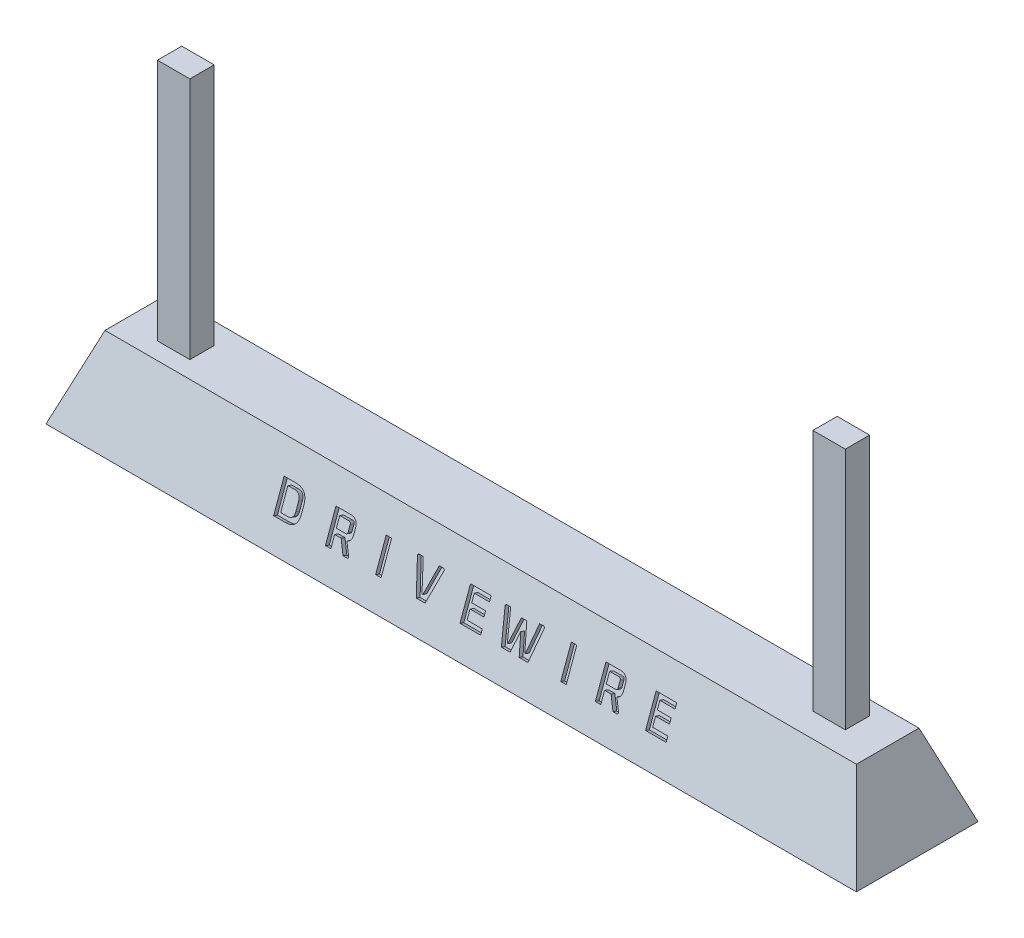
from build123d import *

# Parameters (mm, degrees)
SKETCH1_W           = 200
SKETCH1_H           = 30
BOSS_EXTRUDE1_DEPTH = 20
BOSS_EXTRUDE1_TAPER = 20
SKETCH3_W           = 8
SKETCH3_H           = 6
BOSS_EXTRUDE3_DEPTH = 60
SKETCH4_W           = 1.337512244
SKETCH4_H           = 7.615728082
SKETCH4_W_2         = 1.337512245
CUT_EXTRUDE2_DEPTH  = 1


with BuildPart() as part:
    # Sketch1 → Boss-Extrude1 (new body)
    with BuildSketch(Plane(origin=(0, 0, 0), x_dir=(1, 0, 0), z_dir=(0, 1, 0))):
        Rectangle(SKETCH1_W, SKETCH1_H)
    extrude(amount=BOSS_EXTRUDE1_DEPTH, taper=BOSS_EXTRUDE1_TAPER)

    # Sketch3 → Boss-Extrude3 (add)
    with BuildSketch(Plane(origin=(0, 20, 0), x_dir=(1, 0, 0), z_dir=(0, 1, 0))):
        with Locations((-80, -0.494868003)):
            Rectangle(SKETCH3_W, SKETCH3_H)
        with Locations((80, 1.255131997)):
            Rectangle(SKETCH3_W, SKETCH3_H)
    extrude(amount=BOSS_EXTRUDE3_DEPTH)

    # Sketch4 → Cut-Extrude2 (cut)
    # profile 1 of 9: a face of its own
    with BuildSketch(Plane(origin=(0, 4.820907073, 13.245333323), x_dir=(1, 0, 0), z_dir=(0, 0.34202014332566905, 0.9396926207859083))):
        with BuildLine():
            Line((-46.095717469, 1.487191126), (-46.095717469, 9.102919208))
            Line((-46.095717469, 9.102919208), (-43.190634528, 9.102919208))
            add(Edge.make_bspline(
                [(-43.190634528, 9.102919208), (-43.071016195, 9.101063594), (-42.839167214, 9.097466971), (-42.502816107, 9.061896878), (-42.189339489, 9.004442857), (-41.898969141, 8.921388731), (-41.630719016, 8.817603166), (-41.385787117, 8.688163869), (-41.164198119, 8.535376879), (-40.965184893, 8.359709943), (-40.791209599, 8.159075208), (-40.639480395, 7.935645525), (-40.512641735, 7.68810333), (-40.409506924, 7.417614154), (-40.329013102, 7.124237478), (-40.27076589, 6.807419281), (-40.235600513, 6.4672997), (-40.231916291, 6.23282818), (-40.230020236, 6.112159325)],
                knots=[0, 0, 0, 0, 1.188713315, 2.304011127, 3.357802465, 4.352913975, 5.301847974, 6.21197883, 7.100084463, 7.971523922, 8.843438996, 9.732912908, 10.649926474, 11.601855752, 12.605664396, 13.669791362, 14.800777136, 16, 16, 16, 16], degree=3))
            Line((-40.230020236, 6.112159325), (-40.230020236, 4.477951008))
            add(Edge.make_bspline(
                [(-40.230020236, 4.477951008), (-40.231916291, 4.357282153), (-40.235600513, 4.122810633), (-40.27076589, 3.782691052), (-40.329013102, 3.465872856), (-40.409506924, 3.17249618), (-40.512641735, 2.902007004), (-40.639480395, 2.654464808), (-40.791209599, 2.431035125), (-40.965184893, 2.23040039), (-41.164198119, 2.054733454), (-41.385787117, 1.901946465), (-41.630719016, 1.772507167), (-41.898969141, 1.668721603), (-42.189339489, 1.585667477), (-42.502816107, 1.528213456), (-42.839167214, 1.492643362), (-43.071016195, 1.489046739), (-43.190634528, 1.487191126)],
                knots=[0, 0, 0, 0, 1.199222864, 2.330208638, 3.394335604, 4.398144248, 5.350073526, 6.267087092, 7.156561004, 8.028476078, 8.899915537, 9.78802117, 10.698152026, 11.647086025, 12.642197535, 13.695988873, 14.811286685, 16, 16, 16, 16], degree=3))
            Line((-43.190634528, 1.487191126), (-46.095717469, 1.487191126))
        make_face()
        with BuildLine():
            Line((-44.758205225, 2.704121009), (-43.112890637, 2.704121009))
            add(Edge.make_bspline(
                [(-43.112890637, 2.704121009), (-43.050452885, 2.705450542), (-42.929553728, 2.708024936), (-42.753677974, 2.724678408), (-42.590372998, 2.756772498), (-42.43853406, 2.799620774), (-42.298123955, 2.852912071), (-42.1701269, 2.919795972), (-42.054686071, 3.000023191), (-41.951395571, 3.092236215), (-41.859634223, 3.196245295), (-41.781870799, 3.313641342), (-41.714595908, 3.442605433), (-41.661589422, 3.584708947), (-41.618330602, 3.737401123), (-41.588372135, 3.902605016), (-41.571389778, 4.079880115), (-41.568842183, 4.202372642), (-41.567532481, 4.265345266)],
                knots=[0, 0, 0, 0, 1.189055845, 2.302386679, 3.359069874, 4.353701447, 5.3037939, 6.213754028, 7.096558538, 7.973888864, 8.844546497, 9.729989503, 10.648878363, 11.608371854, 12.612694507, 13.667504363, 14.800878928, 16, 16, 16, 16], degree=3))
            Line((-41.567532481, 4.265345266), (-41.567532481, 6.324765068))
            add(Edge.make_bspline(
                [(-41.567532481, 6.324765068), (-41.568848685, 6.387735705), (-41.571408927, 6.510224369), (-41.588302473, 6.687526597), (-41.618659227, 6.853138496), (-41.66092653, 7.006154839), (-41.715025976, 7.1478701), (-41.781819482, 7.27648839), (-41.859648506, 7.393857292), (-41.951388044, 7.497886227), (-42.054702084, 7.590045938), (-42.170069329, 7.670469959), (-42.298521234, 7.736675512), (-42.437865912, 7.793011539), (-42.590732691, 7.832638647), (-42.75361426, 7.865642307), (-42.929571297, 7.882027387), (-43.050458868, 7.884640035), (-43.112890637, 7.885989324)],
                knots=[0, 0, 0, 0, 1.199026098, 2.332310896, 3.387037208, 4.400978033, 5.350995236, 6.269811316, 7.155184193, 8.025772867, 8.903033706, 9.785768295, 10.695656352, 11.649349095, 12.641196174, 13.697795677, 14.811038332, 16, 16, 16, 16], degree=3))
            Line((-43.112890637, 7.885989324), (-44.758205225, 7.885989324))
            Line((-44.758205225, 7.885989324), (-44.758205225, 2.704121009))
        make_face(mode=Mode.SUBTRACT)
    # profile 2 of 9: a face of its own
    with BuildSketch(Plane(origin=(0, 4.820907073, 13.245333323), x_dir=(1, 0, 0), z_dir=(0, 0.34202014332566905, 0.9396926207859083))):
        with BuildLine():
            Line((-33.301294292, 1.487191126), (-33.301294292, 9.102919208))
            Line((-33.301294292, 9.102919208), (-29.661610913, 9.102919208))
            add(Edge.make_bspline(
                [(-29.661610913, 9.102919208), (-29.589614719, 9.102074763), (-29.449482762, 9.100431154), (-29.246471318, 9.076989674), (-29.056839312, 9.043030786), (-28.880853646, 8.994606398), (-28.720053185, 8.928240293), (-28.571394001, 8.851797666), (-28.438384108, 8.757985451), (-28.318236613, 8.651702956), (-28.21377424, 8.529528839), (-28.119599546, 8.395882845), (-28.044776032, 8.244692591), (-27.98013773, 8.081151637), (-27.934039487, 7.902336217), (-27.899132955, 7.710428428), (-27.876062479, 7.504701619), (-27.874370439, 7.362471788), (-27.873501424, 7.289423958)],
                knots=[0, 0, 0, 0, 1.182087601, 2.300791764, 3.352191054, 4.345104074, 5.292142859, 6.205423244, 7.085151355, 7.958895877, 8.83341756, 9.720281201, 10.637273285, 11.597255171, 12.604621065, 13.664564823, 14.800543674, 16, 16, 16, 16], degree=3))
            Line((-27.873501424, 7.289423958), (-27.873501424, 6.031242215))
            add(Edge.make_bspline(
                [(-27.873501424, 6.031242215), (-27.874464345, 5.974096599), (-27.876339132, 5.862835254), (-27.889478742, 5.700270568), (-27.909249593, 5.545865322), (-27.939777941, 5.400260946), (-27.977000963, 5.262964281), (-28.025489039, 5.13554136), (-28.080539059, 5.015548017), (-28.146148104, 4.904489897), (-28.218836245, 4.801092898), (-28.300076791, 4.706367636), (-28.391434774, 4.622358032), (-28.490195388, 4.54600513), (-28.596804481, 4.476785319), (-28.713436597, 4.419065256), (-28.837500215, 4.366880238), (-28.925118395, 4.341676565), (-28.969848946, 4.328809666)],
                knots=[0, 0, 0, 0, 1.245139748, 2.424261664, 3.552145235, 4.634785591, 5.663774039, 6.648438548, 7.602271101, 8.537187548, 9.454898112, 10.353671205, 11.250669234, 12.154305774, 13.071799223, 14.014989741, 14.986618954, 16, 16, 16, 16], degree=3))
            Line((-28.969848946, 4.328809666), (-27.654549242, 1.769607709))
            Line((-27.654549242, 1.769607709), (-27.817970073, 1.487191126))
            Line((-27.817970073, 1.487191126), (-28.958742676, 1.487191126))
            Line((-28.958742676, 1.487191126), (-30.362892541, 4.230439845))
            Line((-30.362892541, 4.230439845), (-31.963782048, 4.230439845))
            Line((-31.963782048, 4.230439845), (-31.963782048, 1.487191126))
            Line((-31.963782048, 1.487191126), (-33.301294292, 1.487191126))
        make_face()
        with BuildLine():
            Line((-31.963782048, 5.447369728), (-29.693343113, 5.447369728))
            add(Edge.make_bspline(
                [(-29.693343113, 5.447369728), (-29.655643601, 5.448680399), (-29.584157294, 5.45116571), (-29.484636933, 5.475196569), (-29.399137561, 5.513354866), (-29.328619054, 5.568411857), (-29.275233646, 5.641189363), (-29.236829852, 5.728806678), (-29.215406721, 5.831910858), (-29.212530949, 5.90527247), (-29.211013668, 5.943978664)],
                knots=[0, 0, 0, 0, 1.139197889, 2.160161876, 3.076811787, 3.954193982, 4.834491076, 5.780300629, 6.828868231, 8, 8, 8, 8], degree=3))
            Line((-29.211013668, 5.943978664), (-29.211013668, 7.400486659))
            add(Edge.make_bspline(
                [(-29.211013668, 7.400486659), (-29.212511837, 7.438655638), (-29.215329398, 7.510438915), (-29.236629188, 7.611147159), (-29.276206866, 7.695865068), (-29.328036715, 7.768306041), (-29.399766615, 7.821240771), (-29.484320676, 7.860293585), (-29.584441713, 7.88158384), (-29.655700221, 7.884466523), (-29.693343113, 7.885989324)],
                knots=[0, 0, 0, 0, 1.168286561, 2.197162201, 3.124224936, 4.014521899, 4.891922844, 5.818985579, 6.84786122, 8, 8, 8, 8], degree=3))
            Line((-29.693343113, 7.885989324), (-31.963782048, 7.885989324))
            Line((-31.963782048, 7.885989324), (-31.963782048, 5.447369728))
        make_face(mode=Mode.SUBTRACT)
    # profile 3 of 9: a face of its own
    with BuildSketch(Plane(origin=(0, 4.820907073, 13.245333323), x_dir=(1, 0, 0), z_dir=(0, 0.34202014332566905, 0.9396926207859083))):
        with Locations((-20.244287157, 5.295055167)):
            Rectangle(SKETCH4_W, SKETCH4_H)
    # profile 4 of 9: a face of its own
    with BuildSketch(Plane(origin=(0, 4.820907073, 13.245333323), x_dir=(1, 0, 0), z_dir=(0, 0.34202014332566905, 0.9396926207859083))):
        Polygon((-13.108508606, 8.837955335), (-12.932394894, 9.102919208), (-11.769409751, 9.102919208), (-9.894036711, 2.704121009), (-9.686190799, 2.704121009), (-7.810817759, 9.102919208), (-6.638312956, 9.102919208), (-6.473305515, 8.837955335), (-8.710425639, 1.487191126), (-10.882494752, 1.487191126), align=None)
    # profile 5 of 9: a face of its own
    with BuildSketch(Plane(origin=(0, 4.820907073, 13.245333323), x_dir=(1, 0, 0), z_dir=(0, 0.34202014332566905, 0.9396926207859083))):
        Polygon((-0.096719856, 1.487191126), (-0.096719856, 9.102919208), (4.991538468, 9.102919208), (4.991538468, 7.885989324), (1.240792388, 7.897095595), (1.240792388, 6.043935095), (4.661523585, 6.032828825), (4.661523585, 4.827005212), (1.240792388, 4.838111482), (1.240792388, 2.704121009), (4.991538468, 2.693014739), (4.991538468, 1.487191126), align=None)
    # profile 6 of 9: a face of its own
    with BuildSketch(Plane(origin=(0, 4.820907073, 13.245333323), x_dir=(1, 0, 0), z_dir=(0, 0.34202014332566905, 0.9396926207859083))):
        Polygon((8.528092196, 8.837955335), (8.715312178, 9.102919208), (9.8116597, 9.102919208), (11.160278214, 2.704121009), (11.280860576, 2.704121009), (12.718329251, 8.330240129), (14.044735225, 8.330240129), (15.47109763, 2.704121009), (15.602786262, 2.704121009), (16.951404776, 9.102919208), (18.047752298, 9.102919208), (18.23497228, 8.837955335), (16.665814973, 1.487191126), (14.50485213, 1.487191126), (13.376772408, 5.967777814), (12.258212346, 1.487191126), (10.108355773, 1.487191126), align=None)
    # profile 7 of 9: a face of its own
    with BuildSketch(Plane(origin=(0, 4.820907073, 13.245333323), x_dir=(1, 0, 0), z_dir=(0, 0.34202014332566905, 0.9396926207859083))):
        with Locations((25.450081333, 5.295055167)):
            Rectangle(SKETCH4_W_2, SKETCH4_H)
    # profile 8 of 9: a face of its own
    with BuildSketch(Plane(origin=(0, 4.820907073, 13.245333323), x_dir=(1, 0, 0), z_dir=(0, 0.34202014332566905, 0.9396926207859083))):
        with BuildLine():
            Line((33.310940662, 1.487191126), (33.310940662, 9.102919208))
            Line((33.310940662, 9.102919208), (36.950624041, 9.102919208))
            add(Edge.make_bspline(
                [(36.950624041, 9.102919208), (37.022620234, 9.102074763), (37.162752192, 9.100431154), (37.365763636, 9.076989674), (37.555395641, 9.043030786), (37.731381307, 8.994606398), (37.892181769, 8.928240293), (38.040840953, 8.851797666), (38.173850846, 8.757985451), (38.293998341, 8.651702956), (38.398460714, 8.529528839), (38.492635408, 8.395882845), (38.567458921, 8.244692591), (38.632097224, 8.081151637), (38.678195467, 7.902336217), (38.713101998, 7.710428428), (38.736172474, 7.504701619), (38.737864515, 7.362471788), (38.73873353, 7.289423958)],
                knots=[0, 0, 0, 0, 1.182087601, 2.300791764, 3.352191054, 4.345104074, 5.292142859, 6.205423244, 7.085151355, 7.958895877, 8.83341756, 9.720281201, 10.637273285, 11.597255171, 12.604621065, 13.664564823, 14.800543674, 16, 16, 16, 16], degree=3))
            Line((38.73873353, 7.289423958), (38.73873353, 6.031242215))
            add(Edge.make_bspline(
                [(38.73873353, 6.031242215), (38.737770609, 5.974096599), (38.735895821, 5.862835254), (38.722756212, 5.700270568), (38.70298536, 5.545865322), (38.672457013, 5.400260946), (38.635233991, 5.262964281), (38.586745914, 5.13554136), (38.531695895, 5.015548017), (38.46608685, 4.904489897), (38.393398708, 4.801092898), (38.312158162, 4.706367636), (38.22080018, 4.622358032), (38.122039566, 4.54600513), (38.015430472, 4.476785319), (37.898798357, 4.419065256), (37.774734739, 4.366880238), (37.687116559, 4.341676565), (37.642386008, 4.328809666)],
                knots=[0, 0, 0, 0, 1.245139748, 2.424261664, 3.552145235, 4.634785591, 5.663774039, 6.648438548, 7.602271101, 8.537187548, 9.454898112, 10.353671205, 11.250669234, 12.154305774, 13.071799223, 14.014989741, 14.986618954, 16, 16, 16, 16], degree=3))
            Line((37.642386008, 4.328809666), (38.957685712, 1.769607709))
            Line((38.957685712, 1.769607709), (38.79426488, 1.487191126))
            Line((38.79426488, 1.487191126), (37.653492278, 1.487191126))
            Line((37.653492278, 1.487191126), (36.249342413, 4.230439845))
            Line((36.249342413, 4.230439845), (34.648452906, 4.230439845))
            Line((34.648452906, 4.230439845), (34.648452906, 1.487191126))
            Line((34.648452906, 1.487191126), (33.310940662, 1.487191126))
        make_face()
        with BuildLine():
            Line((34.648452906, 5.447369728), (36.91889184, 5.447369728))
            add(Edge.make_bspline(
                [(36.91889184, 5.447369728), (36.956591353, 5.448680399), (37.02807766, 5.45116571), (37.12759802, 5.475196569), (37.213097393, 5.513354866), (37.283615899, 5.568411857), (37.337001307, 5.641189363), (37.375405102, 5.728806678), (37.396828233, 5.831910858), (37.399704005, 5.90527247), (37.401221285, 5.943978664)],
                knots=[0, 0, 0, 0, 1.139197889, 2.160161876, 3.076811787, 3.954193982, 4.834491076, 5.780300629, 6.828868231, 8, 8, 8, 8], degree=3))
            Line((37.401221285, 5.943978664), (37.401221285, 7.400486659))
            add(Edge.make_bspline(
                [(37.401221285, 7.400486659), (37.399723117, 7.438655638), (37.396905555, 7.510438915), (37.375605766, 7.611147159), (37.336028088, 7.695865068), (37.284198239, 7.768306041), (37.212468339, 7.821240771), (37.127914278, 7.860293585), (37.027793241, 7.88158384), (36.956534732, 7.884466523), (36.91889184, 7.885989324)],
                knots=[0, 0, 0, 0, 1.168286561, 2.197162201, 3.124224936, 4.014521899, 4.891922844, 5.818985579, 6.84786122, 8, 8, 8, 8], degree=3))
            Line((36.91889184, 7.885989324), (34.648452906, 7.885989324))
            Line((34.648452906, 7.885989324), (34.648452906, 5.447369728))
        make_face(mode=Mode.SUBTRACT)
    # profile 9 of 9: a face of its own
    with BuildSketch(Plane(origin=(0, 4.820907073, 13.245333323), x_dir=(1, 0, 0), z_dir=(0, 0.34202014332566905, 0.9396926207859083))):
        Polygon((45.699191674, 1.487191126), (45.699191674, 9.102919208), (50.787449999, 9.102919208), (50.787449999, 7.885989324), (47.036703919, 7.897095595), (47.036703919, 6.043935095), (50.457435115, 6.032828825), (50.457435115, 4.827005212), (47.036703919, 4.838111482), (47.036703919, 2.704121009), (50.787449999, 2.693014739), (50.787449999, 1.487191126), align=None)
    extrude(amount=-CUT_EXTRUDE2_DEPTH, mode=Mode.SUBTRACT)


solid = part.part
